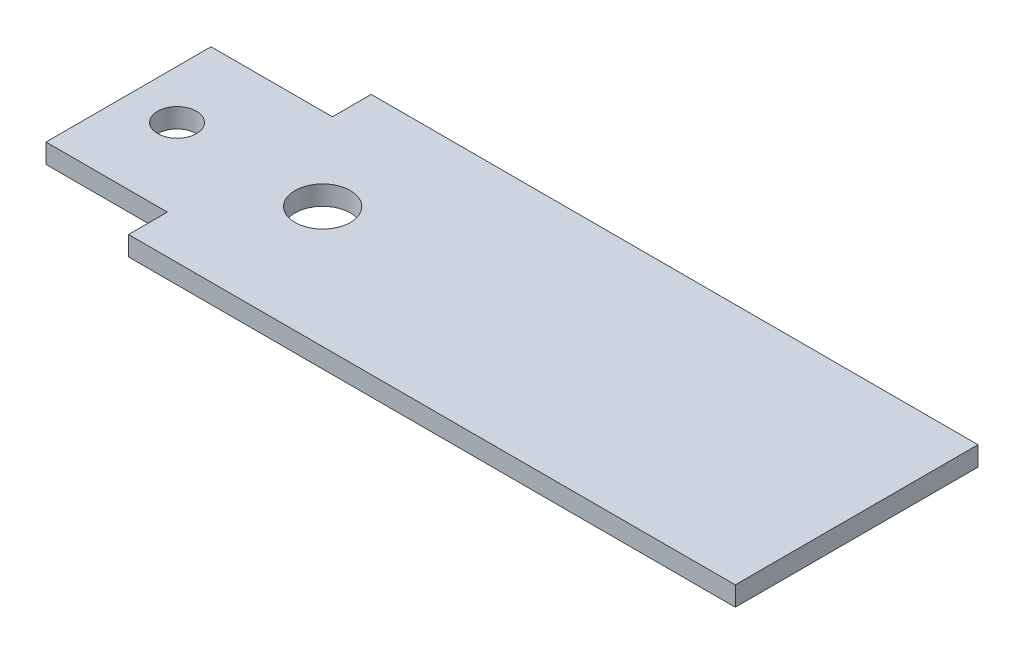
from build123d import *

# Parameters (mm, degrees)
SKETCH1_W           = 150
SKETCH1_H           = 50
BOSS_EXTRUDE1_DEPTH = 4
SKETCH2_R           = 4
SKETCH2_R_2         = 5.7
CUT_EXTRUDE1_DEPTH  = 4
SKETCH3_W           = 25
SKETCH3_H           = 8
CUT_EXTRUDE2_DEPTH  = 4


with BuildPart() as part:
    # Sketch1 → Boss-Extrude1 (new body)
    with BuildSketch(Plane(origin=(0, 0, 0), x_dir=(1, 0, 0), z_dir=(0, 1, 0))):
        Rectangle(SKETCH1_W, SKETCH1_H)
    extrude(amount=BOSS_EXTRUDE1_DEPTH)

    # Sketch2 → Cut-Extrude1 (cut)
    with BuildSketch(Plane.XZ):
        with Locations(Location((-65, 0, 0), (0, 0, 270))):
            Circle(SKETCH2_R)
        with Locations(Location((-35, 0, 0), (0, 0, 270))):
            Circle(SKETCH2_R_2)
    extrude(amount=-CUT_EXTRUDE1_DEPTH, mode=Mode.SUBTRACT)

    # Sketch3 → Cut-Extrude2 (cut)
    with BuildSketch(Plane(origin=(0, 4, 0), x_dir=(1, 0, 0), z_dir=(0, 1, 0))):
        with Locations((-62.5, 21)):
            Rectangle(SKETCH3_W, SKETCH3_H)
        with Locations((-62.5, -21)):
            Rectangle(SKETCH3_W, SKETCH3_H)
    extrude(amount=-CUT_EXTRUDE2_DEPTH, mode=Mode.SUBTRACT)


solid = part.part
